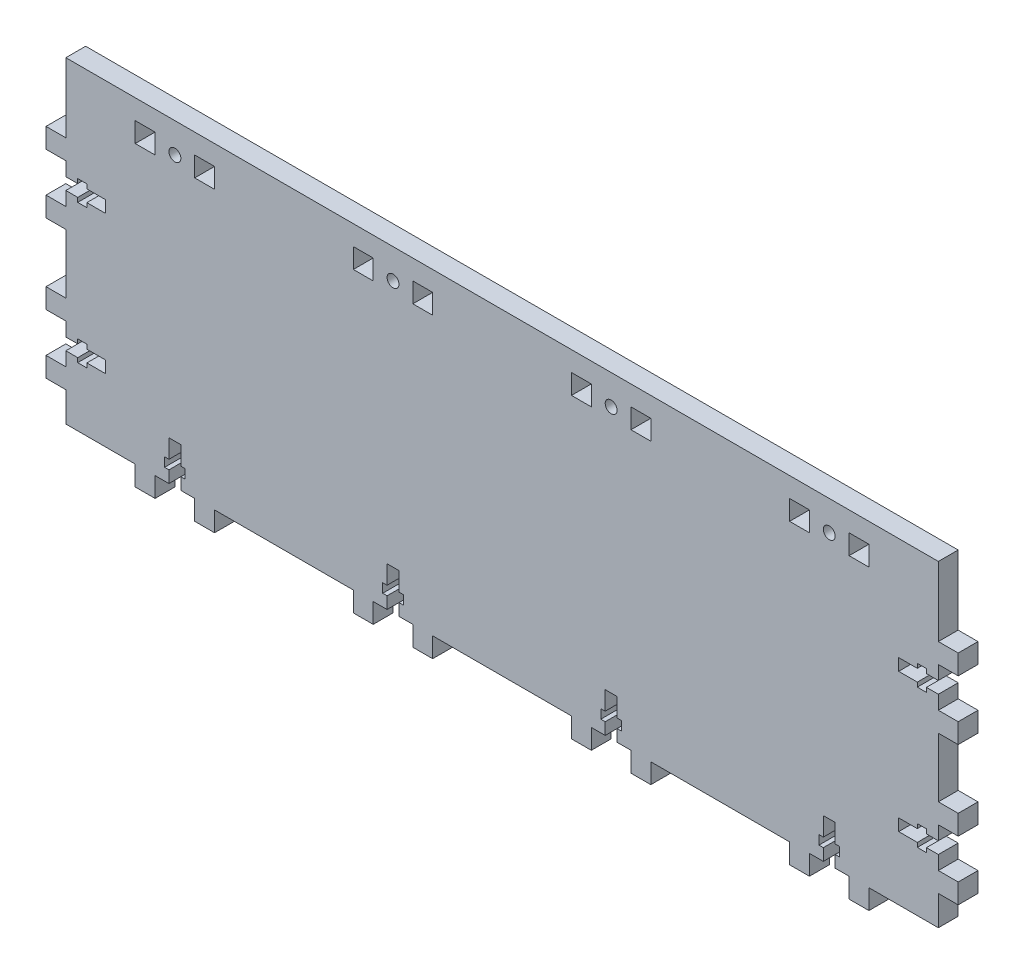
from build123d import *

# Parameters (mm, degrees)
SKETCH1_W           = 5
SKETCH1_H           = 5
SKETCH1_R           = 1.5
BOSS_EXTRUDE2_DEPTH = 5


with BuildPart() as part:
    # Sketch1 → Boss-Extrude2 (new body)
    with BuildSketch(Plane.XY):
        Polygon((-110, 80), (-110, 62.5), (-115, 62.5), (-115, 57.5), (-110, 57.5), (-110, 54), (-107, 54), (-107, 55.1), (-104.7, 55.1), (-104.7, 54), (-100, 54), (-100, 51), (-104.7, 51), (-104.7, 49.9), (-107, 49.9), (-107, 51), (-110, 51), (-110, 47.5), (-115, 47.5), (-115, 42.5), (-110, 42.5), (-110, 27.5), (-115, 27.5), (-115, 22.5), (-110, 22.5), (-110, 19), (-107, 19), (-107, 20.1), (-104.7, 20.1), (-104.7, 19), (-100, 19), (-100, 16), (-104.7, 16), (-104.7, 14.9), (-107, 14.9), (-107, 16), (-110, 16), (-110, 12.5), (-115, 12.5), (-115, 7.5), (-110, 7.5), (-110, 0), (-92.5, 0), (-92.5, -5), (-87.5, -5), (-87.5, 0), (-84, 0), (-84, 3), (-85.1, 3), (-85.1, 5.3), (-84, 5.3), (-84, 10), (-81, 10), (-81, 5.3), (-79.9, 5.3), (-79.9, 3), (-81, 3), (-81, 0), (-77.5, 0), (-77.5, -5), (-72.5, -5), (-72.5, 0), (-37.5, 0), (-37.5, -5), (-32.5, -5), (-32.5, 0), (-29, 0), (-29, 3), (-30.1, 3), (-30.1, 5.3), (-29, 5.3), (-29, 10), (-26, 10), (-26, 5.3), (-24.9, 5.3), (-24.9, 3), (-26, 3), (-26, 0), (-22.5, 0), (-22.5, -5), (-17.5, -5), (-17.5, 0), (17.5, 0), (17.5, -5), (22.5, -5), (22.5, 0), (26, 0), (26, 3), (24.9, 3), (24.9, 5.3), (26, 5.3), (26, 10), (29, 10), (29, 5.3), (30.1, 5.3), (30.1, 3), (29, 3), (29, 0), (32.5, 0), (32.5, -5), (37.5, -5), (37.5, 0), (72.5, 0), (72.5, -5), (77.5, -5), (77.5, 0), (81, 0), (81, 3), (79.9, 3), (79.9, 5.3), (81, 5.3), (81, 10), (84, 10), (84, 5.3), (85.1, 5.3), (85.1, 3), (84, 3), (84, 0), (87.5, 0), (87.5, -5), (92.5, -5), (92.5, 0), (110, 0), (110, 7.5), (115, 7.5), (115, 12.5), (110, 12.5), (110, 16), (107, 16), (107, 14.9), (104.7, 14.9), (104.7, 16), (100, 16), (100, 19), (104.7, 19), (104.7, 20.1), (107, 20.1), (107, 19), (110, 19), (110, 22.5), (115, 22.5), (115, 27.5), (110, 27.5), (110, 42.5), (115, 42.5), (115, 47.5), (110, 47.5), (110, 51), (107, 51), (107, 49.9), (104.7, 49.9), (104.7, 51), (100, 51), (100, 54), (104.7, 54), (104.7, 55.1), (107, 55.1), (107, 54), (110, 54), (110, 57.5), (115, 57.5), (115, 62.5), (110, 62.5), (110, 80), align=None)
        with Locations((-90, 72.5)):
            Rectangle(SKETCH1_W, SKETCH1_H, mode=Mode.SUBTRACT)
        with Locations((-82.5, 72.5)):
            Circle(SKETCH1_R, mode=Mode.SUBTRACT)
        with Locations((-75, 72.5)):
            Rectangle(SKETCH1_W, SKETCH1_H, mode=Mode.SUBTRACT)
        with Locations((-35, 72.5)):
            Rectangle(SKETCH1_W, SKETCH1_H, mode=Mode.SUBTRACT)
        with Locations((-27.5, 72.5)):
            Circle(SKETCH1_R, mode=Mode.SUBTRACT)
        with Locations((-20, 72.5)):
            Rectangle(SKETCH1_W, SKETCH1_H, mode=Mode.SUBTRACT)
        with Locations((20, 72.5)):
            Rectangle(SKETCH1_W, SKETCH1_H, mode=Mode.SUBTRACT)
        with Locations((27.5, 72.5)):
            Circle(SKETCH1_R, mode=Mode.SUBTRACT)
        with Locations((35, 72.5)):
            Rectangle(SKETCH1_W, SKETCH1_H, mode=Mode.SUBTRACT)
        with Locations((75, 72.5)):
            Rectangle(SKETCH1_W, SKETCH1_H, mode=Mode.SUBTRACT)
        with Locations((82.5, 72.5)):
            Circle(SKETCH1_R, mode=Mode.SUBTRACT)
        with Locations((90, 72.5)):
            Rectangle(SKETCH1_W, SKETCH1_H, mode=Mode.SUBTRACT)
    extrude(amount=BOSS_EXTRUDE2_DEPTH)


solid = part.part
